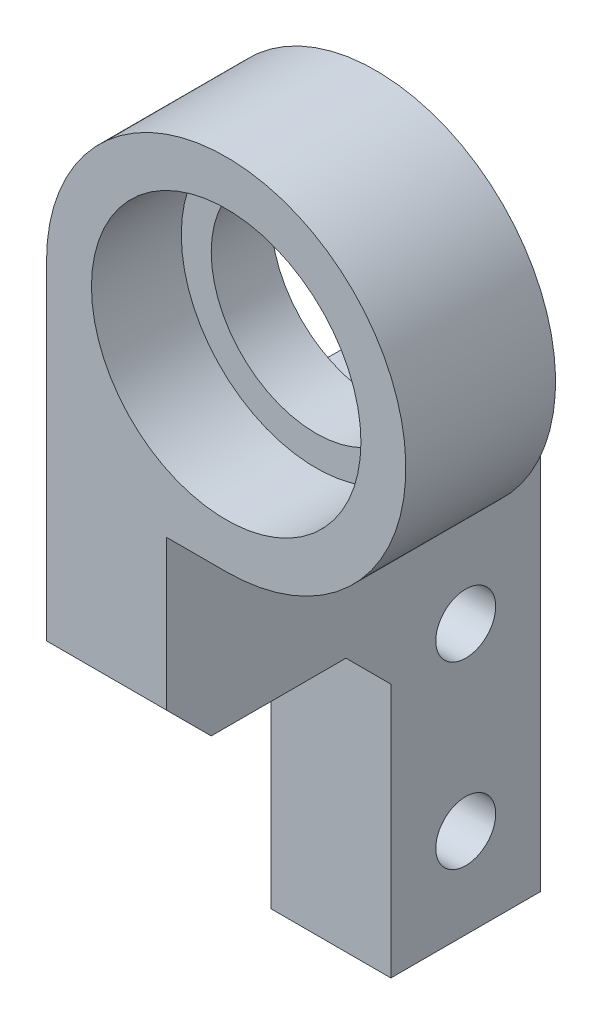
from build123d import *

# Parameters (mm, degrees)
SKETCH_1_R               = 7
EXTRUDE_1_DEPTH          = 12.5
CUT_EXTRUDE_3_DEPTH      = 64.097147321
CUT_EXTRUDE_3_DEPTH_BACK = 64.097147321
SKETCH_5_OUTSIDE_W       = 40.342
SKETCH_5_OUTSIDE_H       = 72.342
SKETCH_2_R               = 2
CUT_EXTRUDE_1_DEPTH      = 64.097147321
SKETCH_4_R               = 9
CUT_EXTRUDE_2_DEPTH      = 6
CHAMFER_1_SIZE           = 3


with BuildPart() as part:
    # 草图1 → 凸台-拉伸1 (new, symmetric)
    with BuildSketch(Plane.XY):
        with BuildLine():
            Line((0, 0), (8, 0))
            Line((8, 0), (8, 33))
            Line((8, 33), (12, 33))
            ThreePointArc((12, 33), (20.485281374, 53.485281374), (0, 45))
            Line((0, 45), (0, 0))
        make_face()
        with Locations((12, 45)):
            Circle(SKETCH_1_R, mode=Mode.SUBTRACT)
    extrude(amount=EXTRUDE_1_DEPTH, both=True)

    # 草图5 outside → 切除-拉伸3 (cut, two sides: drawn at the far end of the back side and taken through both)
    with BuildSketch(Plane(origin=(0, 0, 0), x_dir=(0, 0, -1), z_dir=(1, 0, 0)).offset(-CUT_EXTRUDE_3_DEPTH_BACK)):
        with Locations((0, 28.5)):
            Rectangle(SKETCH_5_OUTSIDE_W, SKETCH_5_OUTSIDE_H)
        Polygon((-12.5, 57), (-2.5, 57), (-2.5, 30), (12.5, 30), (12.5, 0), (2.5, 0), (2.5, 20), (-12.5, 20), align=None, mode=Mode.SUBTRACT)
    extrude(amount=CUT_EXTRUDE_3_DEPTH + CUT_EXTRUDE_3_DEPTH_BACK, mode=Mode.SUBTRACT)

    # 草图2 → 切除-拉伸1 (cut, through all)
    with BuildSketch(Plane.ZY):
        with Locations((-7.5, 18)):
            Circle(SKETCH_2_R)
        with Locations((-7.5, 6)):
            Circle(SKETCH_2_R)
    extrude(amount=-CUT_EXTRUDE_1_DEPTH, mode=Mode.SUBTRACT)

    # 草图4 → 切除-拉伸2 (cut)
    with BuildSketch(Plane.XY.offset(12.5)):
        with Locations((12, 45)):
            Circle(SKETCH_4_R)
    extrude(amount=-CUT_EXTRUDE_2_DEPTH, mode=Mode.SUBTRACT)

    # 倒角1
    chamfer_1_edges = [part.edges().sort_by_distance(p)[0] for p in [
        (4, 30, 2.5),
        (4, 30, -12.5),
        (4, 20, -2.5),
        (4, 20, 12.5),
    ]]
    chamfer(chamfer_1_edges, length=CHAMFER_1_SIZE)


solid = part.part
